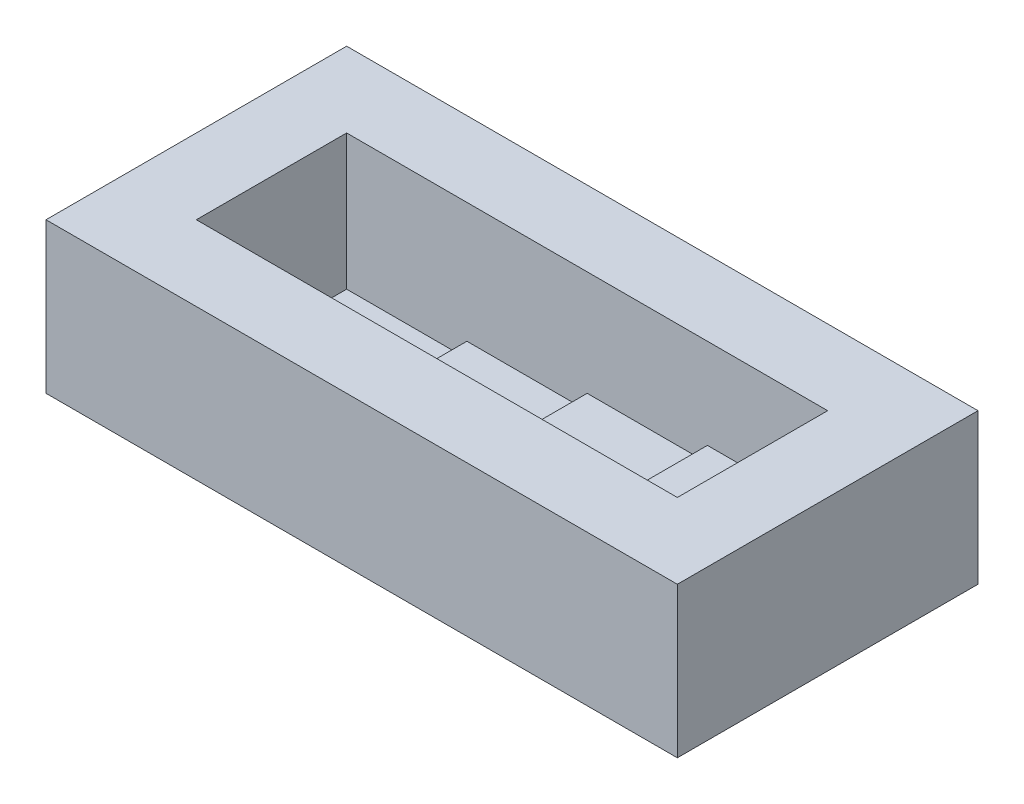
from build123d import *

# Parameters (mm, degrees)
BOSS_EXTRUDE1_DEPTH = 10
SKETCH6_W           = 10
SKETCH6_H           = 10
BOSS_EXTRUDE2_DEPTH = 5
SKETCH7_W           = 37
SKETCH7_H           = 10
BOSS_EXTRUDE3_DEPTH = 5
SKETCH8_W           = 15
SKETCH8_H           = 10
BOSS_EXTRUDE4_DEPTH = 5
SKETCH9_W           = 42
SKETCH9_H           = 10
BOSS_EXTRUDE5_DEPTH = 5


with BuildPart() as part:
    # Sketch3 → Boss-Extrude1 (new body)
    with BuildSketch(Plane.XY):
        Polygon((32, 4), (32, 0), (20, 0), (0, 0), (0, 1), (8, 1), (8, 2), (16, 2), (16, 3), (24, 3), (24, 4), align=None)
    extrude(amount=BOSS_EXTRUDE1_DEPTH)

    # Sketch6 → Boss-Extrude2 (add)
    with BuildSketch(Plane(origin=(0, 0, 0), x_dir=(0, 0, -1), z_dir=(1, 0, 0))):
        with Locations((-5, 5)):
            Rectangle(SKETCH6_W, SKETCH6_H)
    extrude(amount=-BOSS_EXTRUDE2_DEPTH)

    # Sketch7 → Boss-Extrude3 (add)
    with BuildSketch(Plane(origin=(0, 0, 0), x_dir=(-1, 0, 0), z_dir=(0, 0, -1))):
        with Locations((-13.5, 5)):
            Rectangle(SKETCH7_W, SKETCH7_H)
    extrude(amount=BOSS_EXTRUDE3_DEPTH)

    # Sketch8 → Boss-Extrude4 (add)
    with BuildSketch(Plane(origin=(32, 0, 0), x_dir=(0, 0, -1), z_dir=(1, 0, 0))):
        with Locations((-2.5, 5)):
            Rectangle(SKETCH8_W, SKETCH8_H)
    extrude(amount=BOSS_EXTRUDE4_DEPTH)

    # Sketch9 → Boss-Extrude5 (add)
    with BuildSketch(Plane.XY.offset(10)):
        with Locations((16, 5)):
            Rectangle(SKETCH9_W, SKETCH9_H)
    extrude(amount=BOSS_EXTRUDE5_DEPTH)


solid = part.part
